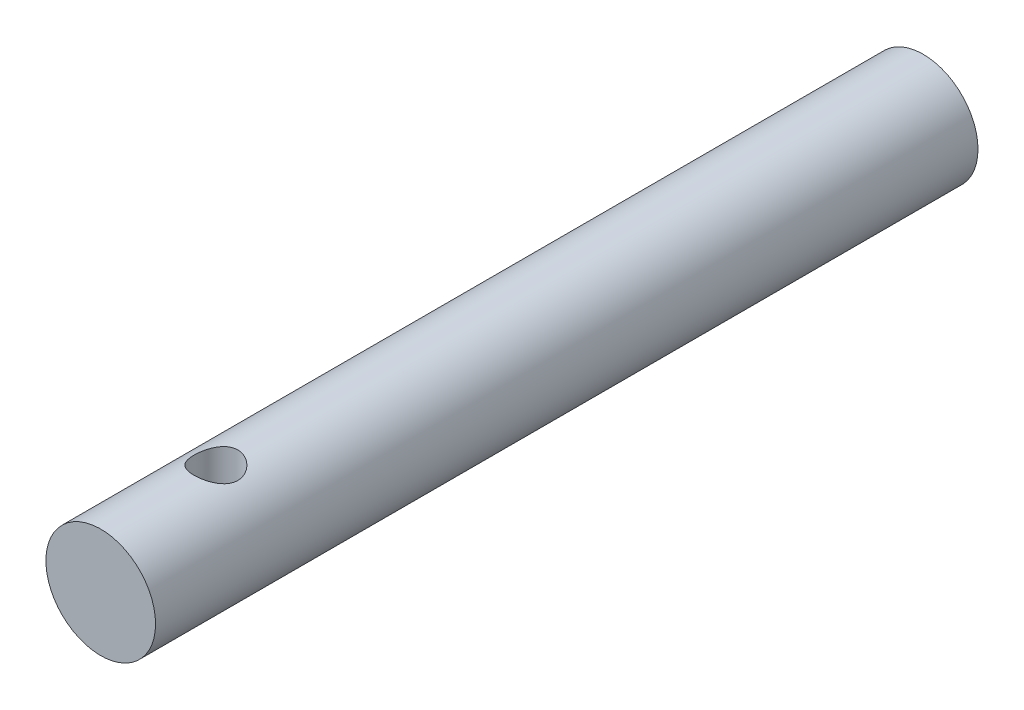
from build123d import *

# Parameters (mm, degrees)
SKETCH_1_R               = 10
EXTRUDE_1_DEPTH          = 150
CUT_EXTRUDE_1_DEPTH      = 151.665191733
CUT_EXTRUDE_1_DEPTH_BACK = 151.665191733
SKETCH_2_R               = 4


with BuildPart() as part:
    # Эскиз1 → Бобышка-Вытянуть1 (new body)
    with BuildSketch(Plane.XY):
        Circle(SKETCH_1_R)
    extrude(amount=EXTRUDE_1_DEPTH)

    # Эскиз2 → Вырез-Вытянуть1 (cut, two sides: drawn at the far end of the back side and taken through both)
    with BuildSketch(Plane(origin=(0, 0, 0), x_dir=(1, 0, 0), z_dir=(0, 1, 0)).offset(-CUT_EXTRUDE_1_DEPTH_BACK)):
        with Locations(Location((0, -129, 0), (0, 0, 270))):
            Circle(SKETCH_2_R)
    extrude(amount=CUT_EXTRUDE_1_DEPTH + CUT_EXTRUDE_1_DEPTH_BACK, mode=Mode.SUBTRACT)


solid = part.part
